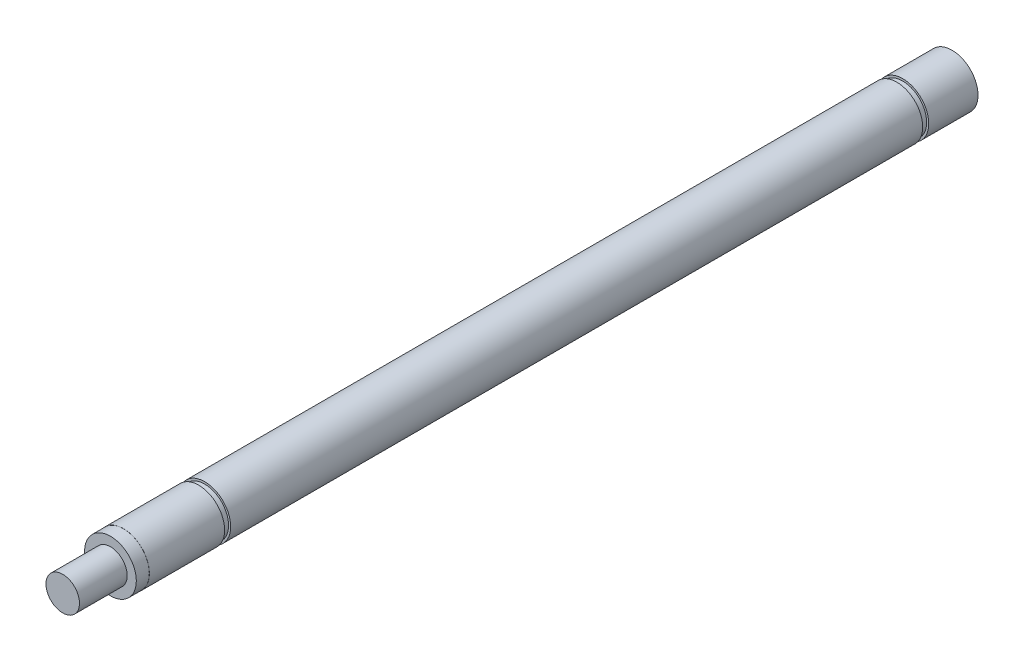
from build123d import *


with BuildPart() as part:
    # Sketch1 → Revolve1 (revolve)
    with BuildSketch(Plane(origin=(0, 0, 0), x_dir=(1, 0, 0), z_dir=(0, 1, 0))):
        Polygon((3.175, 99.795553682), (0, 99.795553682), (0, -9.017), (2.05, -9.017), (2.05, -3.175), (3.1623, -3.175), (3.1623, -1.5875), (3.175, -1.5875), (3.175, 7.62), (2.921, 7.62), (2.921, 8.3566), (3.175, 8.3566), (3.175, 93.032803682), (2.921, 93.032803682), (2.921, 93.769403682), (3.175, 93.769403682), align=None)
    revolve(axis=Axis((0, 0, 9.017), (0, 0, -1)))


solid = part.part
